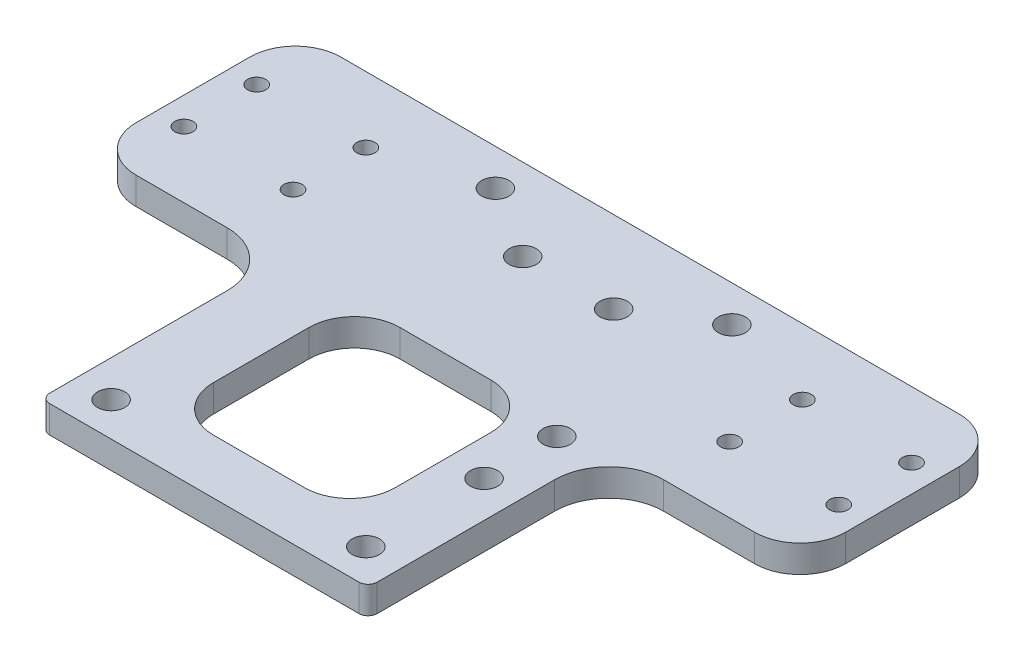
from build123d import *

# Parameters (mm, degrees)
SKETCH_1_W          = 78
SKETCH_1_H          = 22.5
SKETCH_1_R          = 1
EXTRUDE_1_DEPTH     = 3
FILLET_1_R          = 5
SKETCH_2_R          = 1.5
SKETCH_2_W          = 20
SKETCH_2_H          = 6
EXTRUDE_2_DEPTH     = 3
SKETCH_4_R          = 1.5
CUT_EXTRUDE_1_DEPTH = 29.5
SKETCH_6_R          = 1.5
CUT_EXTRUDE_3_DEPTH = 39
FILLET_7_R          = 6
SKETCH_7_R          = 1.5
CUT_EXTRUDE_4_DEPTH = 10
FILLET_9_R          = 1
FILLET_10_R         = 5


with BuildPart() as part:
    # 草图1 → 凸台-拉伸1 (new body)
    with BuildSketch(Plane(origin=(0, 0, 0), x_dir=(1, 0, 0), z_dir=(0, 1, 0))):
        Rectangle(SKETCH_1_W, SKETCH_1_H)
        with Locations(Location((36, 4, 0), (0, 0, 270))):
            Circle(SKETCH_1_R, mode=Mode.SUBTRACT)
        with Locations(Location((24, 4, 0), (0, 0, 90))):
            Circle(SKETCH_1_R, mode=Mode.SUBTRACT)
        with Locations(Location((36, -4, 0), (0, 0, 90))):
            Circle(SKETCH_1_R, mode=Mode.SUBTRACT)
        with Locations(Location((24, -4, 0), (0, 0, 270))):
            Circle(SKETCH_1_R, mode=Mode.SUBTRACT)
        with Locations(Location((-24, -4, 0), (0, 0, 90))):
            Circle(SKETCH_1_R, mode=Mode.SUBTRACT)
        with Locations(Location((-36, -4, 0), (0, 0, 270))):
            Circle(SKETCH_1_R, mode=Mode.SUBTRACT)
        with Locations(Location((-24, 4, 0), (0, 0, 270))):
            Circle(SKETCH_1_R, mode=Mode.SUBTRACT)
        with Locations(Location((-36, 4, 0), (0, 0, 90))):
            Circle(SKETCH_1_R, mode=Mode.SUBTRACT)
    extrude(amount=EXTRUDE_1_DEPTH)

    # 圆角1
    fillet_1_edges = [part.edges().sort_by_distance(p)[0] for p in [
        (39, 1.5, 11.25),
        (-39, 1.5, 11.25),
        (-39, 1.5, -11.25),
        (39, 1.5, -11.25),
    ]]
    fillet(fillet_1_edges, radius=FILLET_1_R)

    # 草图2 → 凸台-拉伸2 (add)
    # profile 1 of 4: a face of its own
    with BuildSketch(Plane(origin=(0, 3, 0), x_dir=(1, 0, 0), z_dir=(0, 1, 0))):
        Polygon((-10, -31.75), (-10, -11.25), (-18, -11.25), (-18, -37.75), (-10, -37.75), align=None)
        with Locations((-14, -21)):
            Circle(SKETCH_2_R, mode=Mode.SUBTRACT)
    # profile 2 of 4: a face of its own
    with BuildSketch(Plane(origin=(0, 3, 0), x_dir=(1, 0, 0), z_dir=(0, 1, 0))):
        with Locations((-14, -21)):
            Circle(SKETCH_2_R)
    # profile 3 of 4: a face of its own
    with BuildSketch(Plane(origin=(0, 3, 0), x_dir=(1, 0, 0), z_dir=(0, 1, 0))):
        Polygon((18, -11.25), (10, -11.25), (10, -31.75), (10, -37.75), (18, -37.75), align=None)
        with Locations(Location((14, -21, 0), (0, 0, 270))):
            Circle(SKETCH_2_R, mode=Mode.SUBTRACT)
    # profile 4 of 4: a face of its own
    with BuildSketch(Plane(origin=(0, 3, 0), x_dir=(1, 0, 0), z_dir=(0, 1, 0))):
        with Locations((0, -34.75)):
            Rectangle(SKETCH_2_W, SKETCH_2_H)
    extrude(amount=-EXTRUDE_2_DEPTH)

    # 草图4 → 切除-拉伸1 (cut)
    with BuildSketch(Plane(origin=(0, 3, 0), x_dir=(1, 0, 0), z_dir=(0, 1, 0))):
        with Locations(Location((13, 7.25, 0), (0, 0, 270))):
            Circle(SKETCH_4_R)
        with Locations(Location((-13, 7.25, 0), (0, 0, 90))):
            Circle(SKETCH_4_R)
        with Locations(Location((5, 2.25, 0), (0, 0, 270))):
            Circle(SKETCH_4_R)
        with Locations(Location((-5, 2.25, 0), (0, 0, 90))):
            Circle(SKETCH_4_R)
    extrude(amount=-CUT_EXTRUDE_1_DEPTH, mode=Mode.SUBTRACT)

    # 草图6 → 切除-拉伸3 (cut)
    with BuildSketch(Plane(origin=(0, 3, 0), x_dir=(1, 0, 0), z_dir=(0, 1, 0))):
        with Locations(Location((14, -13, 0), (0, 0, 270))):
            Circle(SKETCH_6_R)
    extrude(amount=-CUT_EXTRUDE_3_DEPTH, mode=Mode.SUBTRACT)

    # 圆角7
    fillet_7_edges = [part.edges().sort_by_distance(p)[0] for p in [
        (-18, 1.5, 11.25),
        (18, 1.5, 11.25),
    ]]
    fillet(fillet_7_edges, radius=FILLET_7_R)

    # 草图7 → 切除-拉伸4 (cut)
    with BuildSketch(Plane(origin=(0, 3, 0), x_dir=(1, 0, 0), z_dir=(0, 1, 0))):
        with Locations(Location((14, -34, 0), (0, 0, 270))):
            Circle(SKETCH_7_R)
        with Locations(Location((-14, -34, 0), (0, 0, 90))):
            Circle(SKETCH_7_R)
    extrude(amount=-CUT_EXTRUDE_4_DEPTH, mode=Mode.SUBTRACT)

    # 圆角9
    fillet_9_edges = [part.edges().sort_by_distance(p)[0] for p in [
        (18, 1.5, 37.75),
        (-18, 1.5, 37.75),
    ]]
    fillet(fillet_9_edges, radius=FILLET_9_R)

    # 圆角10
    fillet_10_edges = [part.edges().sort_by_distance(p)[0] for p in [
        (-10, 1.5, 11.25),
        (-10, 1.5, 31.75),
        (10, 1.5, 31.75),
        (10, 1.5, 11.25),
    ]]
    fillet(fillet_10_edges, radius=FILLET_10_R)


solid = part.part
